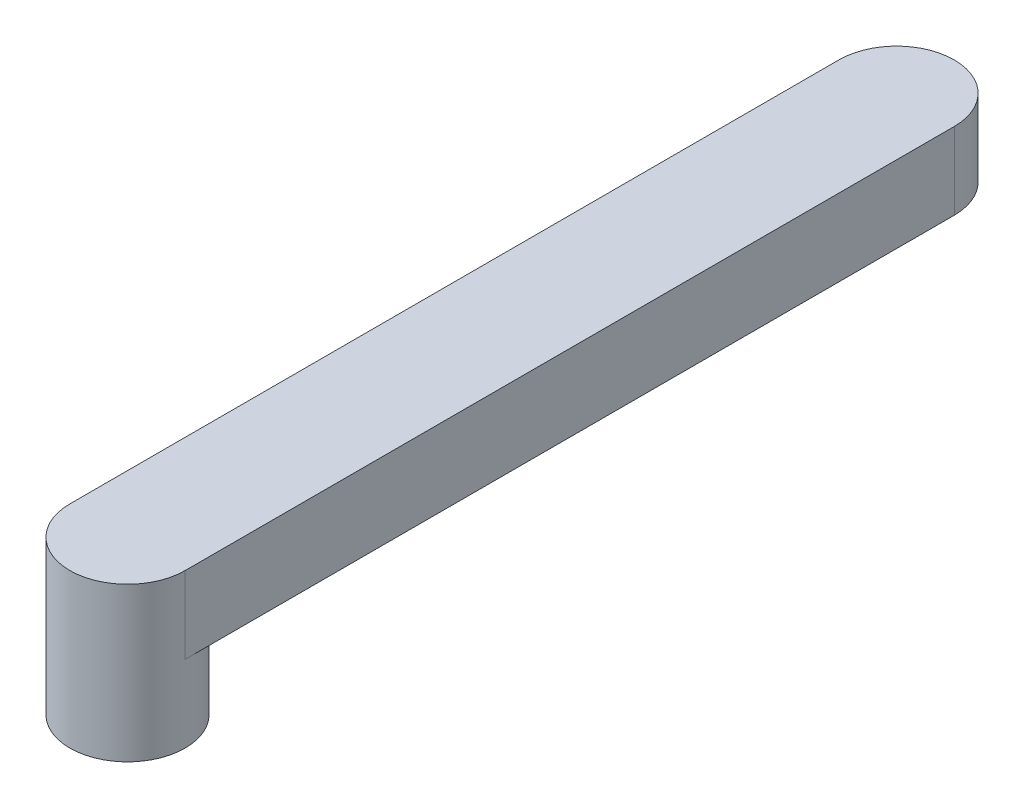
from build123d import *

# Parameters (mm, degrees)
BOSS_EXTRUDE1_DEPTH = 2.54
BOSS_EXTRUDE2_DEPTH = 2.54


with BuildPart() as part:
    # Sketch1 → Boss-Extrude1 (new body)
    with BuildSketch(Plane(origin=(0, 0, 0), x_dir=(1, 0, 0), z_dir=(0, 1, 0))):
        with BuildLine():
            Line((-1.905, 10.16), (-1.905, -15.24))
            ThreePointArc((-1.905, -15.24), (0, -13.335), (1.905, -15.24))
            Line((1.905, -15.24), (1.905, 10.16))
            ThreePointArc((1.905, 10.16), (0, 12.065), (-1.905, 10.16))
        make_face()
    extrude(amount=BOSS_EXTRUDE1_DEPTH)

    # Sketch1<3> → Boss-Extrude2 (add, symmetric)
    with BuildSketch(Plane(origin=(0, 0, 0), x_dir=(1, 0, 0), z_dir=(0, 1, 0))):
        with BuildLine():
            ThreePointArc((-1.905, -15.24), (0, -17.145), (1.905, -15.24))
            ThreePointArc((1.905, -15.24), (0, -13.335), (-1.905, -15.24))
        make_face()
    extrude(amount=BOSS_EXTRUDE2_DEPTH, both=True)


solid = part.part
